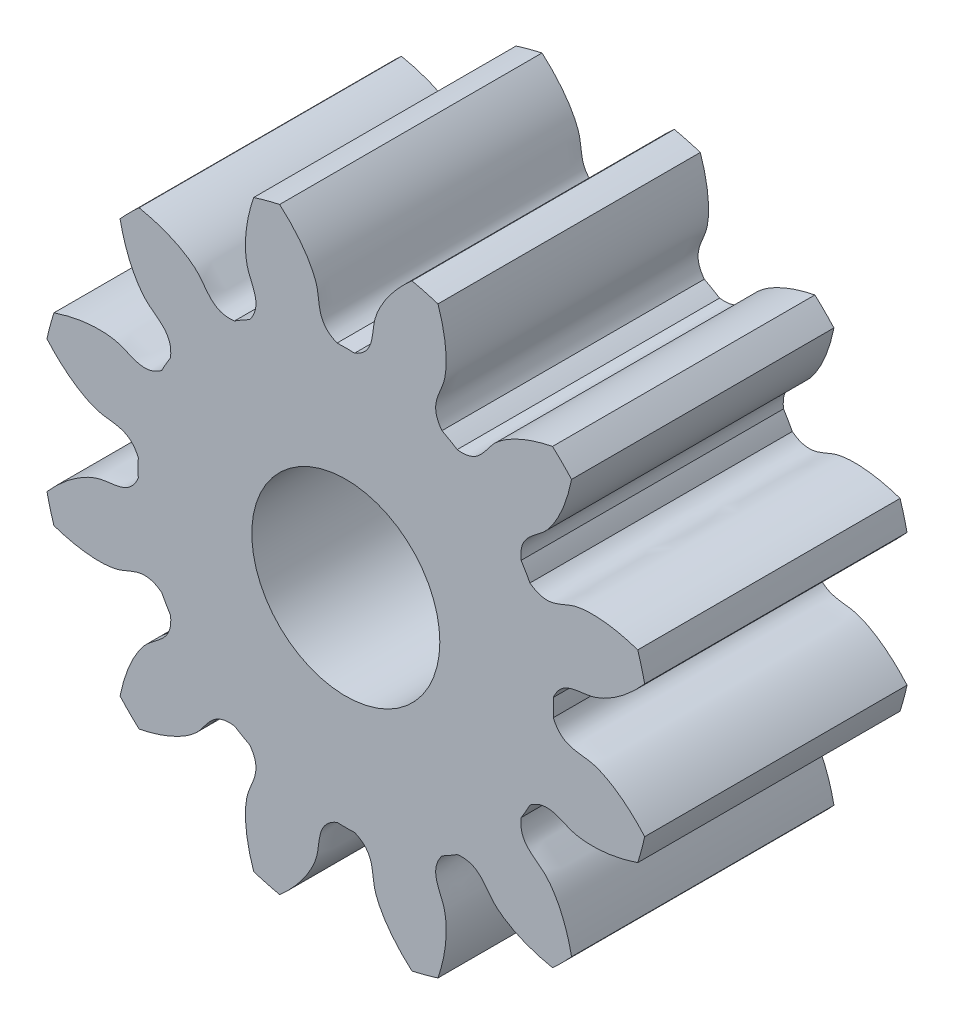
from build123d import *

# Parameters (mm, degrees)
SKETCH_1_R               = 3.5
EXTRUDE_1_DEPTH          = 3
CUT_EXTRUDE_1_DEPTH      = 6.787918451
PATTERN_CIRCULAR_1_COUNT = 12
CUT_EXTRUDE_2_REACH      = 7.688
SKETCH_5_R               = 1.075


with BuildPart() as part:
    # 草图1 → 凸台-拉伸1 (new body)
    with BuildSketch(Plane.XY):
        Circle(SKETCH_1_R)
    extrude(amount=EXTRUDE_1_DEPTH)

    # 草图2 → 切除-拉伸1 (cut, through all)
    with BuildSketch(Plane.XY):
        with BuildLine():
            ThreePointArc((0.100420056, 2.372876063), (0, 2.375), (-0.100420056, 2.372876063))
            add(Edge.make_bspline(
                [(-0.100420056, 2.372876063), (-0.340394435, 2.474653731), (-0.287186739, 2.672409341), (-0.338076094, 2.844740289), (-0.341311927, 2.854952869), (-0.345113625, 2.866166713), (-0.349521434, 2.878363044), (-0.354576313, 2.891521619), (-0.360318258, 2.905621034), (-0.36678678, 2.920638648), (-0.374020716, 2.936550626), (-0.382058239, 2.95333195), (-0.390936819, 2.970956436), (-0.400693193, 2.989396753), (-0.411363332, 3.008624444), (-0.422982412, 3.02860994), (-0.435584786, 3.049322589), (-0.449203949, 3.07073067), (-0.463872517, 3.092801417), (-0.479622192, 3.115501045), (-0.496483738, 3.138794769), (-0.514486952, 3.162646832), (-0.533660639, 3.187020528), (-0.554032585, 3.211878226), (-0.575629533, 3.237181399), (-0.598477155, 3.262890651), (-0.622600033, 3.288965742), (-0.648021632, 3.315365616), (-0.674764279, 3.342048434), (-0.702849139, 3.368971597), (-0.732296196, 3.396091781), (-0.763124233, 3.423364967), (-0.795350811, 3.450746465), (-0.828992247, 3.478190957), (-0.864063604, 3.505652518), (-0.900578664, 3.533084654), (-0.938549918, 3.560440334), (-0.977988547, 3.587672024), (-1.01890441, 3.614731718), (-1.061306025, 3.641570973), (-1.10520056, 3.668140947), (-1.150593819, 3.694392428), (-1.197490231, 3.720275872), (-1.245892835, 3.74574144), (-1.295803277, 3.770739031), (-1.347221796, 3.79521832), (-1.400147219, 3.819128792), (-1.454576948, 3.842419781), (-1.510506963, 3.865040505), (-1.567931802, 3.886940103), (-1.647189853, 3.915363979), (-1.7077968, 3.935050704), (-1.748802701, 3.947485455)],
                knots=[0, 0, 0, 0, 0.218015236, 0.222043642, 0.226545979, 0.231522246, 0.236972443, 0.24289657, 0.249294627, 0.256166614, 0.263512532, 0.271332379, 0.279626157, 0.288393865, 0.297635503, 0.307351072, 0.31754057, 0.328203999, 0.339341357, 0.350952646, 0.363037866, 0.375597015, 0.388630094, 0.402137104, 0.416118043, 0.430572913, 0.445501713, 0.460904444, 0.476781104, 0.493131694, 0.509956215, 0.527254666, 0.545027047, 0.563273358, 0.581993599, 0.601187771, 0.620855872, 0.640997904, 0.661613866, 0.682703758, 0.704267581, 0.726305333, 0.748817015, 0.771802628, 0.795262171, 0.819195644, 0.843603047, 0.868484381, 0.893839644, 0.919668838, 0.945971962, 1, 1, 1, 1], degree=3))
            ThreePointArc((-1.748802701, 3.947485455), (0, 4.317516914), (1.748802701, 3.947485455))
            add(Edge.make_bspline(
                [(0.100420056, 2.372876063), (0.340394435, 2.474653731), (0.287186739, 2.672409341), (0.338076094, 2.844740289), (0.341311927, 2.854952869), (0.345113625, 2.866166713), (0.349521434, 2.878363044), (0.354576313, 2.891521619), (0.360318258, 2.905621034), (0.36678678, 2.920638648), (0.374020716, 2.936550626), (0.382058239, 2.95333195), (0.390936819, 2.970956436), (0.400693193, 2.989396753), (0.411363332, 3.008624444), (0.422982412, 3.02860994), (0.435584786, 3.049322589), (0.449203949, 3.07073067), (0.463872517, 3.092801417), (0.479622192, 3.115501045), (0.496483738, 3.138794769), (0.514486952, 3.162646832), (0.533660639, 3.187020528), (0.554032585, 3.211878226), (0.575629533, 3.237181399), (0.598477155, 3.262890651), (0.622600033, 3.288965742), (0.648021632, 3.315365616), (0.674764279, 3.342048434), (0.702849139, 3.368971597), (0.732296196, 3.396091781), (0.763124233, 3.423364967), (0.795350811, 3.450746465), (0.828992247, 3.478190957), (0.864063604, 3.505652518), (0.900578664, 3.533084654), (0.938549918, 3.560440334), (0.977988547, 3.587672024), (1.01890441, 3.614731718), (1.061306025, 3.641570973), (1.10520056, 3.668140947), (1.150593819, 3.694392428), (1.197490231, 3.720275872), (1.245892835, 3.74574144), (1.295803277, 3.770739031), (1.347221796, 3.79521832), (1.400147219, 3.819128792), (1.454576948, 3.842419781), (1.510506963, 3.865040505), (1.567931802, 3.886940103), (1.647189853, 3.915363979), (1.7077968, 3.935050704), (1.748802701, 3.947485455)],
                knots=[0, 0, 0, 0, 0.218015236, 0.222043642, 0.226545979, 0.231522246, 0.236972443, 0.24289657, 0.249294627, 0.256166614, 0.263512532, 0.271332379, 0.279626157, 0.288393865, 0.297635503, 0.307351072, 0.31754057, 0.328203999, 0.339341357, 0.350952646, 0.363037866, 0.375597015, 0.388630094, 0.402137104, 0.416118043, 0.430572913, 0.445501713, 0.460904444, 0.476781104, 0.493131694, 0.509956215, 0.527254666, 0.545027047, 0.563273358, 0.581993599, 0.601187771, 0.620855872, 0.640997904, 0.661613866, 0.682703758, 0.704267581, 0.726305333, 0.748817015, 0.771802628, 0.795262171, 0.819195644, 0.843603047, 0.868484381, 0.893839644, 0.919668838, 0.945971962, 1, 1, 1, 1], degree=3))
        make_face()
    cut_extrude_1 = extrude(amount=CUT_EXTRUDE_1_DEPTH, mode=Mode.SUBTRACT)

    # 阵列(圆周)1: 切除-拉伸1 ×12 about axis
    pattern_circular_1_axis = Axis((0, 0, 3), (0, 0, -1))
    for i in range(1, PATTERN_CIRCULAR_1_COUNT):
        add(cut_extrude_1.rotate(pattern_circular_1_axis, i * 360 / PATTERN_CIRCULAR_1_COUNT), mode=Mode.SUBTRACT)

    # 草图5 → 切除-拉伸2 (cut, up to next)
    with BuildSketch(Plane.XY.offset(3), mode=Mode.PRIVATE) as cut_extrude_2_sk1:
        Circle(SKETCH_5_R)
    cut_extrude_2_tool1 = extrude(cut_extrude_2_sk1.sketch, amount=-CUT_EXTRUDE_2_REACH, mode=Mode.PRIVATE) & part.part
    add(cut_extrude_2_tool1.solids().sort_by_distance((0, 0, 3))[0], mode=Mode.SUBTRACT)


solid = part.part
